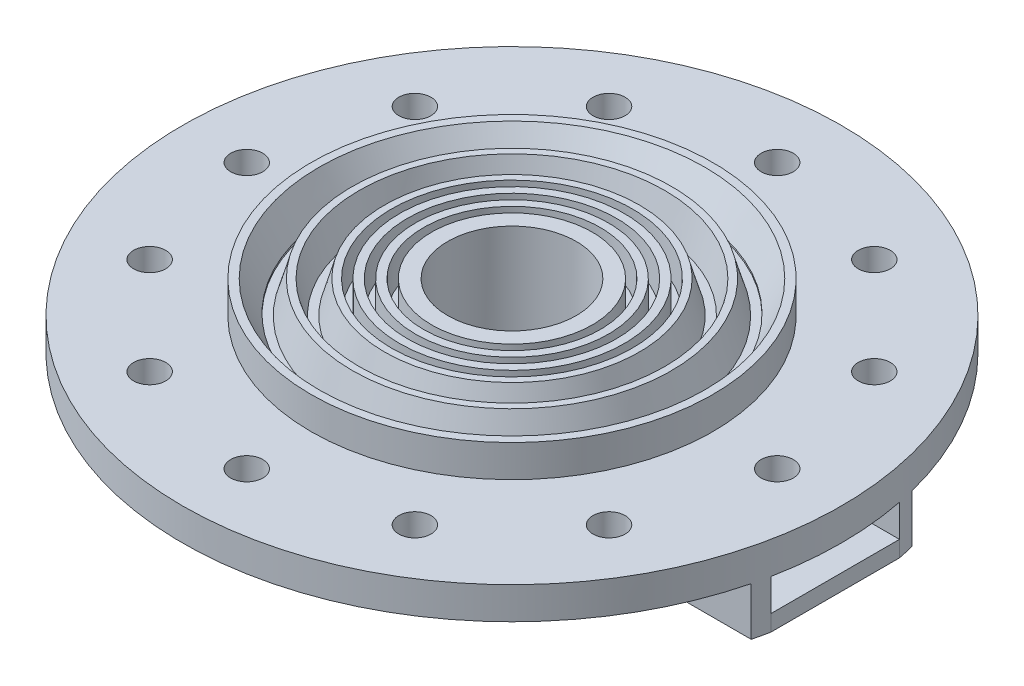
from build123d import *
from build123d.topology import SkipClean

# Parameters (mm, degrees)
SKETCH1_R             = 15.875
SKETCH1_R_2           = 12.7
BOSS_EXTRUDE2_DEPTH   = 12.7
SKETCH1_R_3           = 26.9875
SKETCH1_R_4           = 23.8125
BOSS_EXTRUDE2_2_DEPTH = 12.7
SKETCH1_R_5           = 33.3375
SKETCH1_R_6           = 28.575
BOSS_EXTRUDE2_3_DEPTH = 12.7
SKETCH1_R_7           = 39.6875
SKETCH1_R_8           = 34.925
BOSS_EXTRUDE2_4_DEPTH = 12.7
CHAMFER1_SIZE         = 3.175
CHAMFER1_SIZE2        = 5.971306527
CHAMFER2_SIZE         = 6.35
CHAMFER2_SIZE2        = 1.8208332
CHAMFER3_SIZE         = 1.5875
CHAMFER3_SIZE2        = 6.367114732
CHAMFER4_SIZE         = 6.35
CHAMFER4_SIZE2        = 1.8208332
SKETCH1_20_R          = 65.0875
SKETCH1_20_R_2        = 39.6875
SKETCH1_20_R_3        = 3.175
SKETCH1_20_R_4        = 34.925
SKETCH1_20_R_5        = 33.3375
SKETCH1_20_R_6        = 28.575
SKETCH1_20_R_7        = 26.9875
SKETCH1_20_R_8        = 23.8125
SKETCH1_20_R_9        = 22.225
SKETCH1_20_R_10       = 20.6375
SKETCH1_20_R_11       = 19.05
SKETCH1_20_R_12       = 17.4625
SKETCH1_20_R_13       = 15.875
BOSS_EXTRUDE3_DEPTH   = 6.35
SKETCH1_21_R          = 22.225
SKETCH1_21_R_2        = 20.6375
SKETCH1_21_R_3        = 19.05
SKETCH1_21_R_4        = 17.4625
BOSS_EXTRUDE4_DEPTH   = 12.7
BOSS_EXTRUDE6_START   = -6.35
BOSS_EXTRUDE6_DEPTH   = 6.35
BOSS_EXTRUDE7_START   = 3.175
BOSS_EXTRUDE7_DEPTH   = 3.175
SKETCH4_R             = 3.175
CUT_EXTRUDE1_DEPTH    = 3.175
SKETCH5_R             = 6.35
CUT_EXTRUDE2_DEPTH    = 1.5875
SKETCH5_2_R           = 6.35
CUT_EXTRUDE3_DEPTH    = 12.7


with BuildPart() as part:
    # Sketch1 → Boss-Extrude2 (new body)
    with BuildSketch(Plane(origin=(0, 0, 0), x_dir=(1, 0, 0), z_dir=(0, 1, 0))):
        Circle(SKETCH1_R)
        Circle(SKETCH1_R_2, mode=Mode.SUBTRACT)
    extrude(amount=BOSS_EXTRUDE2_DEPTH)



with BuildPart() as body_2:
    # Sketch1 → Boss-Extrude2 2 (new body)
    with BuildSketch(Plane(origin=(0, 0, 0), x_dir=(1, 0, 0), z_dir=(0, 1, 0))):
        Circle(SKETCH1_R_3)
        Circle(SKETCH1_R_4, mode=Mode.SUBTRACT)
    extrude(amount=BOSS_EXTRUDE2_2_DEPTH)

    # Chamfer4
    chamfer4_edges = [body_2.edges().sort_by_distance(p)[0] for p in [
        (-26.9875, 12.7, 0),
    ]]
    chamfer4_side = [body_2.faces().sort_by_distance(p)[0] for p in [
        (-26.9875, 6.35, 0),
    ]]
    chamfer(chamfer4_edges, length=CHAMFER4_SIZE, length2=CHAMFER4_SIZE2, reference=chamfer4_side[0])


with BuildPart() as body_3:
    # Sketch1 → Boss-Extrude2 3 (new body)
    with BuildSketch(Plane(origin=(0, 0, 0), x_dir=(1, 0, 0), z_dir=(0, 1, 0))):
        Circle(SKETCH1_R_5)
        Circle(SKETCH1_R_6, mode=Mode.SUBTRACT)
    extrude(amount=BOSS_EXTRUDE2_3_DEPTH)

    # Chamfer2
    chamfer2_edges = [body_3.edges().sort_by_distance(p)[0] for p in [
        (-33.3375, 12.7, 0),
    ]]
    chamfer2_side = [body_3.faces().sort_by_distance(p)[0] for p in [
        (-33.3375, 6.35, 0),
    ]]
    chamfer(chamfer2_edges, length=CHAMFER2_SIZE, length2=CHAMFER2_SIZE2, reference=chamfer2_side[0])

    # Chamfer3
    chamfer3_edges = [body_3.edges().sort_by_distance(p)[0] for p in [
        (-28.575, 12.7, 0),
    ]]
    chamfer3_side = [body_3.faces().sort_by_distance(p)[0] for p in [
        (-30.625240848, 12.7, 0),
    ]]
    chamfer(chamfer3_edges, length=CHAMFER3_SIZE, length2=CHAMFER3_SIZE2, reference=chamfer3_side[0])


with BuildPart() as body_4:
    # Sketch1 → Boss-Extrude2 4 (new body)
    with BuildSketch(Plane(origin=(0, 0, 0), x_dir=(1, 0, 0), z_dir=(0, 1, 0))):
        Circle(SKETCH1_R_7)
        Circle(SKETCH1_R_8, mode=Mode.SUBTRACT)
    extrude(amount=BOSS_EXTRUDE2_4_DEPTH)

    # Chamfer1
    chamfer1_edges = [body_4.edges().sort_by_distance(p)[0] for p in [
        (-34.925, 12.7, 0),
    ]]
    chamfer1_side = [body_4.faces().sort_by_distance(p)[0] for p in [
        (-38.564967985, 12.7, 0),
    ]]
    chamfer(chamfer1_edges, length=CHAMFER1_SIZE, length2=CHAMFER1_SIZE2, reference=chamfer1_side[0])


with BuildPart() as part_1:
    add(part.part)

    add(body_2.part)  # Boss-Extrude3 merges body 2

    add(body_3.part)  # Boss-Extrude3 merges body 3

    add(body_4.part)  # Boss-Extrude3 merges body 4
    # Sketch1<20> → Boss-Extrude3 (add)
    # profile 1 of 6: a face of its own
    with BuildSketch(Plane(origin=(0, 0, 0), x_dir=(1, 0, 0), z_dir=(0, 1, 0))):
        Circle(SKETCH1_20_R)
        Circle(SKETCH1_20_R_2, mode=Mode.SUBTRACT)
        with Locations((-26.19375, -45.368905841)):
            Circle(SKETCH1_20_R_3, mode=Mode.SUBTRACT)
        with Locations((-45.368905841, -26.19375)):
            Circle(SKETCH1_20_R_3, mode=Mode.SUBTRACT)
        with Locations((-52.3875, 0)):
            Circle(SKETCH1_20_R_3, mode=Mode.SUBTRACT)
        with Locations((0, -52.3875)):
            Circle(SKETCH1_20_R_3, mode=Mode.SUBTRACT)
        with Locations((26.19375, -45.368905841)):
            Circle(SKETCH1_20_R_3, mode=Mode.SUBTRACT)
        with Locations((45.368905841, -26.19375)):
            Circle(SKETCH1_20_R_3, mode=Mode.SUBTRACT)
        with Locations((-45.368905841, 26.19375)):
            Circle(SKETCH1_20_R_3, mode=Mode.SUBTRACT)
        with Locations((-26.19375, 45.368905841)):
            Circle(SKETCH1_20_R_3, mode=Mode.SUBTRACT)
        with Locations((0, 52.3875)):
            Circle(SKETCH1_20_R_3, mode=Mode.SUBTRACT)
        with Locations((45.368905841, 26.19375)):
            Circle(SKETCH1_20_R_3, mode=Mode.SUBTRACT)
        with Locations((26.19375, 45.368905841)):
            Circle(SKETCH1_20_R_3, mode=Mode.SUBTRACT)
        with Locations((52.3875, 0)):
            Circle(SKETCH1_20_R_3, mode=Mode.SUBTRACT)
    # profile 2 of 6: a face of its own
    with BuildSketch(Plane(origin=(0, 0, 0), x_dir=(1, 0, 0), z_dir=(0, 1, 0))):
        Circle(SKETCH1_20_R_4)
        Circle(SKETCH1_20_R_5, mode=Mode.SUBTRACT)
    # profile 3 of 6: a face of its own
    with BuildSketch(Plane(origin=(0, 0, 0), x_dir=(1, 0, 0), z_dir=(0, 1, 0))):
        Circle(SKETCH1_20_R_6)
        Circle(SKETCH1_20_R_7, mode=Mode.SUBTRACT)
    # profile 4 of 6: a face of its own
    with BuildSketch(Plane(origin=(0, 0, 0), x_dir=(1, 0, 0), z_dir=(0, 1, 0))):
        Circle(SKETCH1_20_R_8)
        Circle(SKETCH1_20_R_9, mode=Mode.SUBTRACT)
    # profile 5 of 6: a face of its own
    with BuildSketch(Plane(origin=(0, 0, 0), x_dir=(1, 0, 0), z_dir=(0, 1, 0))):
        Circle(SKETCH1_20_R_10)
        Circle(SKETCH1_20_R_11, mode=Mode.SUBTRACT)
    # profile 6 of 6: a face of its own
    with BuildSketch(Plane(origin=(0, 0, 0), x_dir=(1, 0, 0), z_dir=(0, 1, 0))):
        Circle(SKETCH1_20_R_12)
        Circle(SKETCH1_20_R_13, mode=Mode.SUBTRACT)
    extrude(amount=BOSS_EXTRUDE3_DEPTH)

    # Sketch1<21> → Boss-Extrude4 (add)
    # profile 1 of 2: a face of its own
    with BuildSketch(Plane(origin=(0, 0, 0), x_dir=(1, 0, 0), z_dir=(0, 1, 0))):
        Circle(SKETCH1_21_R)
        Circle(SKETCH1_21_R_2, mode=Mode.SUBTRACT)
    # profile 2 of 2: a face of its own
    with BuildSketch(Plane(origin=(0, 0, 0), x_dir=(1, 0, 0), z_dir=(0, 1, 0))):
        Circle(SKETCH1_21_R_3)
        Circle(SKETCH1_21_R_4, mode=Mode.SUBTRACT)
    extrude(amount=BOSS_EXTRUDE4_DEPTH)

    # Sketch1<24> → Boss-Extrude6 (add)
    with BuildSketch(Plane(origin=(0, 0, 0), x_dir=(1, 0, 0), z_dir=(0, 1, 0)).offset(BOSS_EXTRUDE6_START)):
        with BuildLine():
            Line((0, 12.7), (63.83645241, 12.7))
            ThreePointArc((63.83645241, 12.7), (63.498994742, 14.291967079), (63.121842743, 15.875))
            Line((63.121842743, 15.875), (0, 15.875))
            ThreePointArc((0, 15.875), (-15.875, 0), (0, -15.875))
            Line((0, -15.875), (63.121842743, -15.875))
            ThreePointArc((63.121842743, -15.875), (63.498994742, -14.291967079), (63.83645241, -12.7))
            Line((63.83645241, -12.7), (0, -12.7))
            ThreePointArc((0, -12.7), (-12.7, 0), (0, 12.7))
        make_face()
    extrude(amount=BOSS_EXTRUDE6_DEPTH)

    # Sketch2 → Boss-Extrude7 (add)
    with SkipClean():  # the faces are left unmerged after this step: merging them gives an invalid solid
        with BuildSketch(Plane(origin=(0, -6.35, 0), x_dir=(-1, 0, 0), z_dir=(0, -1, 0)).offset(BOSS_EXTRUDE7_START)):
            with BuildLine():
                ThreePointArc((0, -15.875), (15.875, 0), (0, 15.875))
                Line((0, 15.875), (-63.121842743, 15.875))
                ThreePointArc((-63.121842743, 15.875), (-63.498994742, 14.291967079), (-63.83645241, 12.7))
                Line((-63.83645241, 12.7), (-63.83645241, -12.7))
                ThreePointArc((-63.83645241, -12.7), (-63.498994742, -14.291967079), (-63.121842743, -15.875))
                Line((-63.121842743, -15.875), (0, -15.875))
            make_face()
        extrude(amount=-BOSS_EXTRUDE7_DEPTH)

    # Sketch4 → Cut-Extrude1 (cut)
    with SkipClean():  # the faces are left unmerged after this step: merging them gives an invalid solid
        with BuildSketch(Plane.XZ.offset(9.525)):
            Circle(SKETCH4_R)
        extrude(amount=-CUT_EXTRUDE1_DEPTH, mode=Mode.SUBTRACT)

    # Sketch5 → Cut-Extrude2 (cut)
    with SkipClean():  # the faces are left unmerged after this step: merging them gives an invalid solid
        with BuildSketch(Plane.XZ.offset(9.525)):
            Circle(SKETCH5_R)
        extrude(amount=-CUT_EXTRUDE2_DEPTH, mode=Mode.SUBTRACT)

    # Sketch5<2> → Cut-Extrude3 (cut)
    with SkipClean():  # the faces are left unmerged after this step: merging them gives an invalid solid
        with BuildSketch(Plane.XZ.offset(9.525)):
            Circle(SKETCH5_2_R)
        extrude(amount=-CUT_EXTRUDE3_DEPTH, mode=Mode.SUBTRACT)


solid = part_1.part
